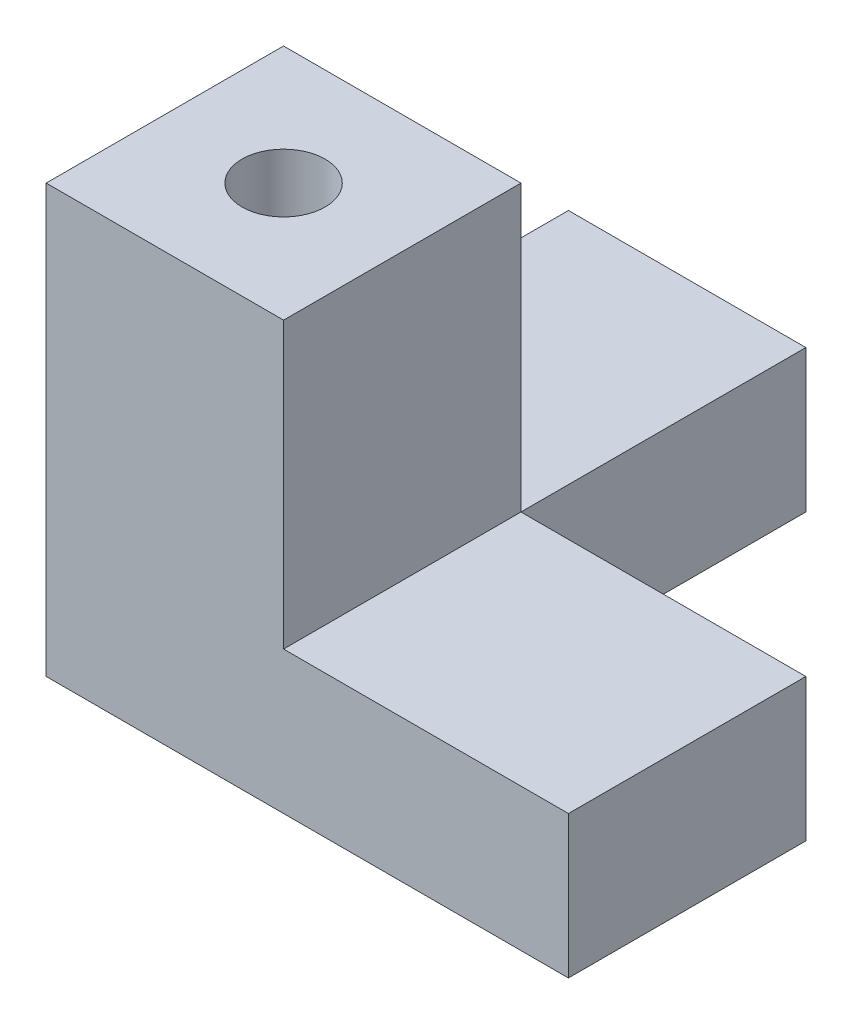
from build123d import *

# Parameters (mm, degrees)
BOSS_EXTRUDE1_DEPTH = 6
SKETCH2_W           = 10
SKETCH2_H           = 10
BOSS_EXTRUDE2_DEPTH = 12
SKETCH3_R           = 1.75
CUT_EXTRUDE1_DEPTH  = 36.944401511
CUT_EXTRUDE2_DEPTH  = 3


with BuildPart() as part:
    # Sketch1 → Boss-Extrude1 (new body)
    with BuildSketch(Plane(origin=(0, 0, 0), x_dir=(1, 0, 0), z_dir=(0, 1, 0))):
        Polygon((0, 0), (0, 22), (10, 22), (10, 10), (22, 10), (22, 0), align=None)
    extrude(amount=BOSS_EXTRUDE1_DEPTH)

    # Sketch2 → Boss-Extrude2 (add)
    with BuildSketch(Plane(origin=(0, 6, 0), x_dir=(1, 0, 0), z_dir=(0, 1, 0))):
        with Locations((5, 5)):
            Rectangle(SKETCH2_W, SKETCH2_H)
    extrude(amount=BOSS_EXTRUDE2_DEPTH)

    # Sketch3 → Cut-Extrude1 (cut, through all)
    with BuildSketch(Plane(origin=(0, 18, 0), x_dir=(1, 0, 0), z_dir=(0, 1, 0))):
        with Locations(Location((5, 5, 0), (0, 0, 270))):
            Circle(SKETCH3_R)
    extrude(amount=-CUT_EXTRUDE1_DEPTH, mode=Mode.SUBTRACT)

    # Sketch4 → Cut-Extrude2 (cut)
    with BuildSketch(Plane.XZ):
        Polygon((1.824573519, -5), (3.41228676, -7.75), (6.58771324, -7.75), (8.175426481, -5), (6.58771324, -2.25), (3.41228676, -2.25), align=None)
    extrude(amount=-CUT_EXTRUDE2_DEPTH, mode=Mode.SUBTRACT)


solid = part.part
